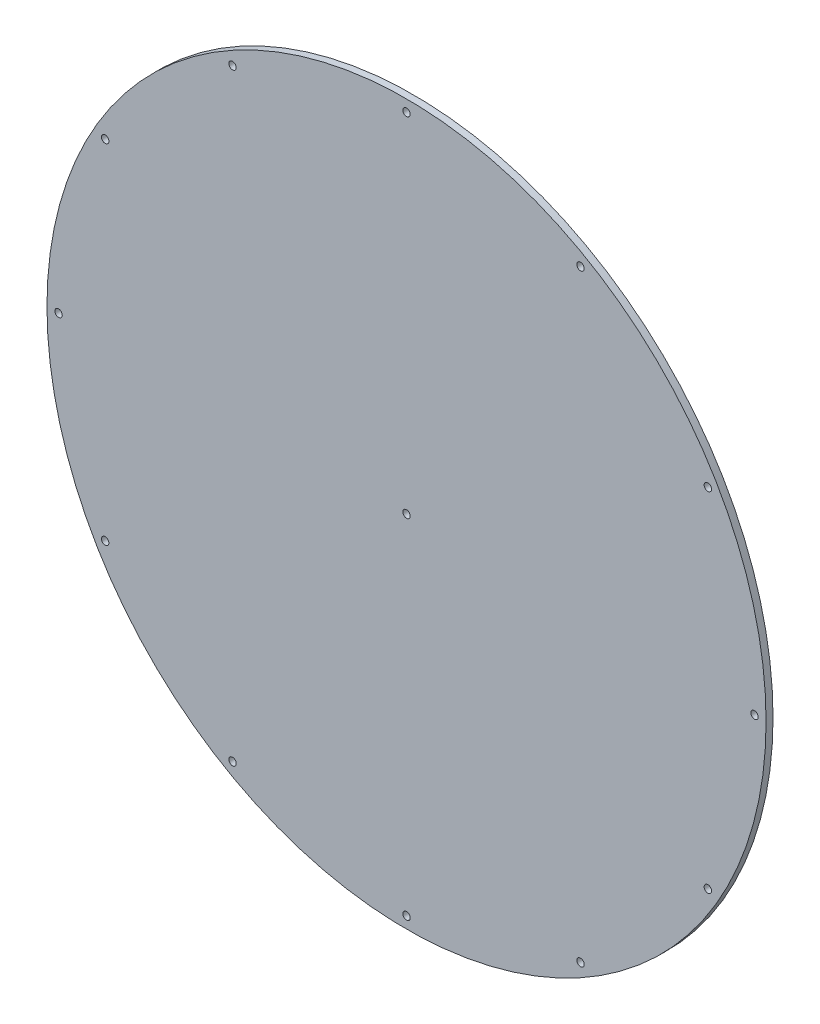
from build123d import *

# Parameters (mm, degrees)
SKETCH1_R           = 155
SKETCH1_R_2         = 1.6
BOSS_EXTRUDE1_DEPTH = 3
SKETCH2_R           = 1.6002
CUT_EXTRUDE1_DEPTH  = 220.223630113
CIRPATTERN1_COUNT   = 12


with BuildPart() as part:
    # Sketch1 → Boss-Extrude1 (new body)
    with BuildSketch(Plane.XY):
        Circle(SKETCH1_R)
        Circle(SKETCH1_R_2, mode=Mode.SUBTRACT)
    extrude(amount=BOSS_EXTRUDE1_DEPTH)

    # Sketch2 → Cut-Extrude1 (cut, through all)
    with BuildSketch(Plane.XY.offset(3)):
        with Locations((-150, 0)):
            Circle(SKETCH2_R)
    cut_extrude1 = extrude(amount=-CUT_EXTRUDE1_DEPTH, mode=Mode.SUBTRACT)

    # CirPattern1: Cut-Extrude1 ×12 about axis
    cirpattern1_axis = Axis((0, 0, 3), (0, 0, 1))
    for i in range(1, CIRPATTERN1_COUNT):
        add(cut_extrude1.rotate(cirpattern1_axis, i * 360 / CIRPATTERN1_COUNT), mode=Mode.SUBTRACT)


solid = part.part
